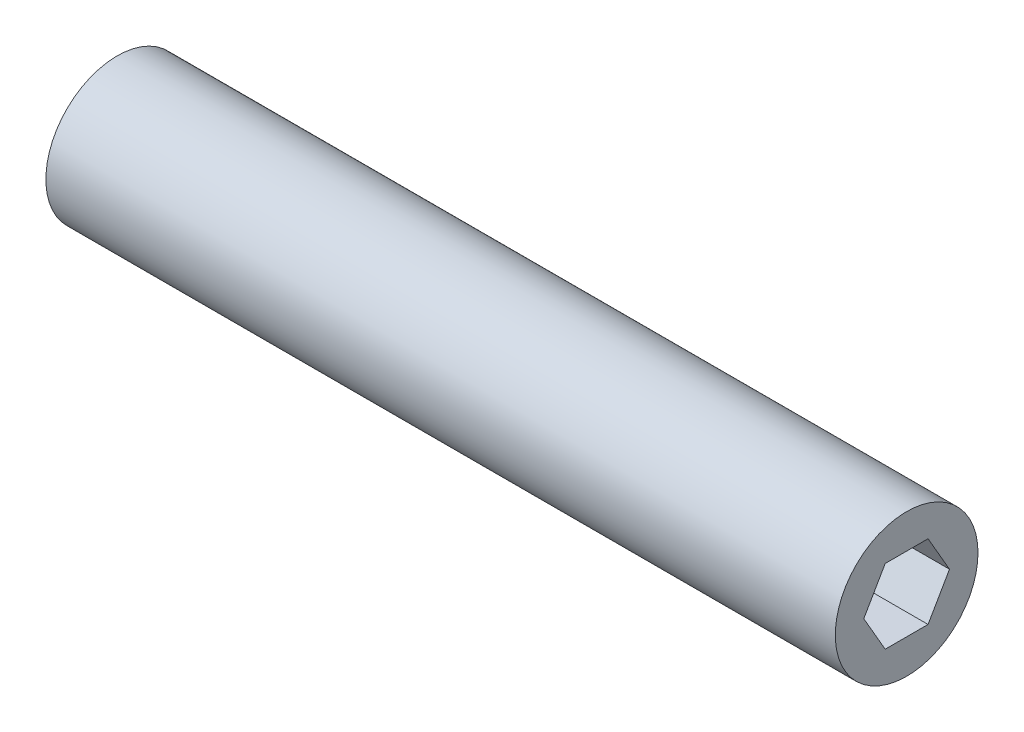
from build123d import *

# Parameters (mm, degrees)
SKETCH1_R           = 12.7
BOSS_EXTRUDE1_DEPTH = 140.49375


with BuildPart() as part:
    # Sketch1 → Boss-Extrude1 (new body)
    with BuildSketch(Plane(origin=(0, 0, 0), x_dir=(0, 0, -1), z_dir=(1, 0, 0))):
        Circle(SKETCH1_R)
        Polygon((7.625642355, 0), (3.812821178, 6.604), (-3.812821178, 6.604), (-7.625642355, 0), (-3.812821178, -6.604), (3.812821178, -6.604), align=None, mode=Mode.SUBTRACT)
    extrude(amount=BOSS_EXTRUDE1_DEPTH)


solid = part.part
